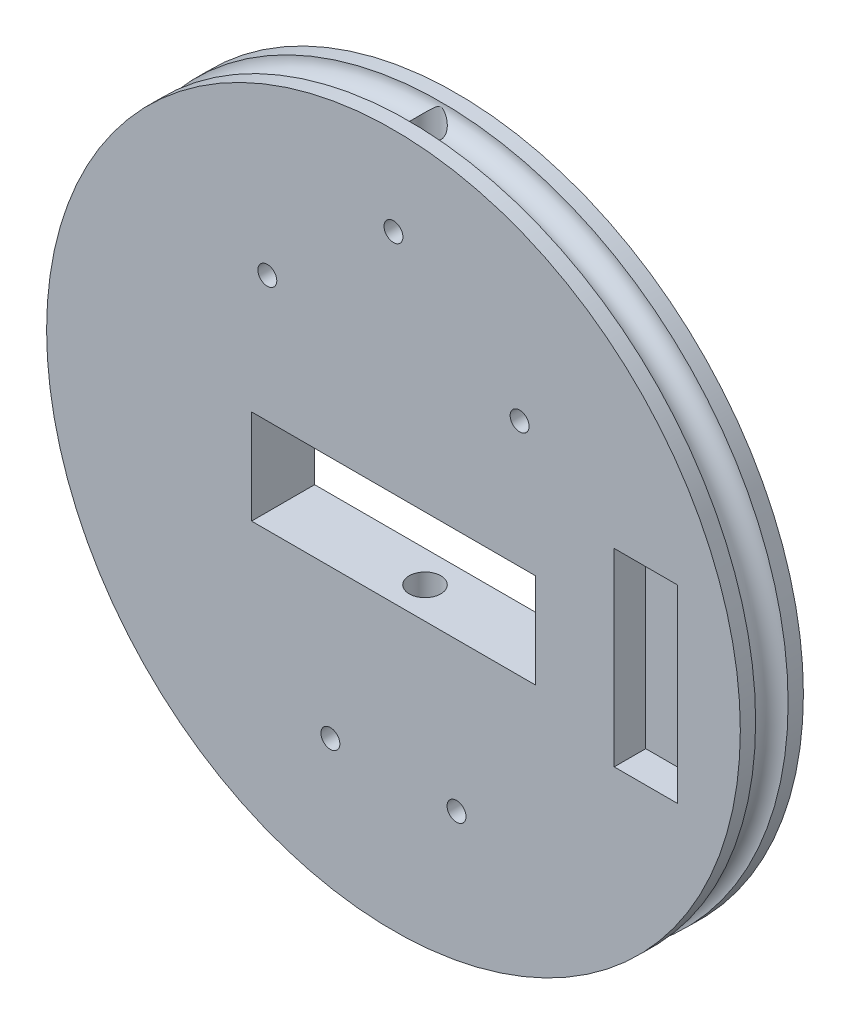
from build123d import *

# Parameters (mm, degrees)
CROQUIS1_R              = 55
CROQUIS1_W              = 45
CROQUIS1_H              = 15
SALIENTE_EXTRUIR1_DEPTH = 10
CROQUIS2_W              = 10
CROQUIS2_H              = 30
SALIENTE_EXTRUIR2_DEPTH = 65
CROQUIS3_R              = 1.5
CORTAR_EXTRUIR1_DEPTH   = 50
CORTAR_EXTRUIR2_DEPTH   = 10
CROQUIS5_R              = 2.5
CORTAR_EXTRUIR3_DEPTH   = 85
CROQUIS8_R              = 1.5
CORTAR_EXTRUIR4_DEPTH   = 10
CROQUIS10_R             = 2.575
CROQUIS11_W             = 10
CROQUIS11_H             = 70
CORTAR_EXTRUIR5_DEPTH   = 30
CORTAR_EXTRUIR6_DEPTH   = 30
SALIENTE_EXTRUIR4_REACH = 80.422
CROQUIS13_W             = 10
CROQUIS13_H             = 30
CROQUIS7_R              = 1.5
CORTAR_EXTRUIR9_DEPTH   = 10


with BuildPart() as part:
    # Croquis1 → Saliente-Extruir1 (new body)
    with BuildSketch(Plane.XY):
        Circle(CROQUIS1_R)
        with Locations((0, -2.5)):
            Rectangle(CROQUIS1_W, CROQUIS1_H, mode=Mode.SUBTRACT)
    extrude(amount=SALIENTE_EXTRUIR1_DEPTH)

    # Croquis2 → Saliente-Extruir2 (add)
    with BuildSketch(Plane.XY.offset(10)):
        with Locations((30, 0)):
            Rectangle(CROQUIS2_W, CROQUIS2_H)
    extrude(amount=SALIENTE_EXTRUIR2_DEPTH)

    # Croquis3 → Cortar-Extruir1 (cut)
    with BuildSketch(Plane.XZ.offset(15)):
        with Locations((30, 70)):
            Circle(CROQUIS3_R)
    extrude(amount=-CORTAR_EXTRUIR1_DEPTH, mode=Mode.SUBTRACT)

    # Croquis4 → Cortar-Extruir2 (cut)
    with BuildSketch(Plane.XZ.offset(15)):
        Polygon((35, 65), (25, 42.602429787), (25, 65), (25, 75), (35, 75), align=None)
    cortar_extruir2 = extrude(amount=-CORTAR_EXTRUIR2_DEPTH, mode=Mode.SUBTRACT)

    # Simetría1: Cortar-Extruir2 across plane
    add(cortar_extruir2.mirror(Plane.ZX), mode=Mode.SUBTRACT)

    # Croquis5 → Cortar-Extruir3 (cut, symmetric)
    with BuildSketch(Plane.XZ.offset(-5)):
        with Locations(Location((0, 5, 0), (0, 0, 270))):
            Circle(CROQUIS5_R)
    extrude(amount=CORTAR_EXTRUIR3_DEPTH, both=True, mode=Mode.SUBTRACT)

    # Croquis8 → Cortar-Extruir4 (cut)
    with BuildSketch(Plane.XY.offset(10)):
        with Locations(Location((9.999999991, -33.6, 0), (0, 0, 180))):
            Circle(CROQUIS8_R)
        with Locations(Location((19.999999995, 25, 0), (0, 0, 180))):
            Circle(CROQUIS8_R)
        with Locations((-20.000000005, 25)):
            Circle(CROQUIS8_R)
        with Locations((-10, -33.6)):
            Circle(CROQUIS8_R)
    extrude(amount=-CORTAR_EXTRUIR4_DEPTH, mode=Mode.SUBTRACT)

    # Croquis10 → Cortar-Revolución1 (revolve, cut)
    with BuildSketch(Plane(origin=(0, 0, 0), x_dir=(1, 0, 0), z_dir=(0, 1, 0))):
        with Locations((-55, -5)):
            Circle(CROQUIS10_R)
    revolve(axis=Axis((0, 0, 0), (0, 0, 1)), mode=Mode.SUBTRACT)

    # Croquis11 → Cortar-Extruir5 (cut)
    with BuildSketch(Plane(origin=(0, 15, 0), x_dir=(1, 0, 0), z_dir=(0, 1, 0))):
        with Locations((30, -40)):
            Rectangle(CROQUIS11_W, CROQUIS11_H)
    extrude(amount=-CORTAR_EXTRUIR5_DEPTH, mode=Mode.SUBTRACT)

    # Croquis12 → Cortar-Extruir6 (cut)
    with BuildSketch(Plane.XZ.offset(-15)):
        Polygon((35, 10), (45, 10), (45, 5), (35, 5), (25, 5), (25, 10), align=None)
    extrude(amount=CORTAR_EXTRUIR6_DEPTH, mode=Mode.SUBTRACT)

    # Croquis13 → Saliente-Extruir4 (add, up to next)
    with BuildSketch(Plane.XY.offset(10), mode=Mode.PRIVATE) as saliente_extruir4_sk1:
        with Locations((30, 0)):
            Rectangle(CROQUIS13_W, CROQUIS13_H)
    saliente_extruir4_tool1 = extrude(saliente_extruir4_sk1.sketch, amount=-SALIENTE_EXTRUIR4_REACH, mode=Mode.PRIVATE) - part.part
    add(saliente_extruir4_tool1.solids().sort_by_distance((30, 0, 10))[0])

    # Croquis7 → Cortar-Extruir9 (cut)
    with BuildSketch(Plane.XY.offset(10)):
        with Locations((0, 41)):
            Circle(CROQUIS7_R)
    extrude(amount=-CORTAR_EXTRUIR9_DEPTH, mode=Mode.SUBTRACT)


solid = part.part
